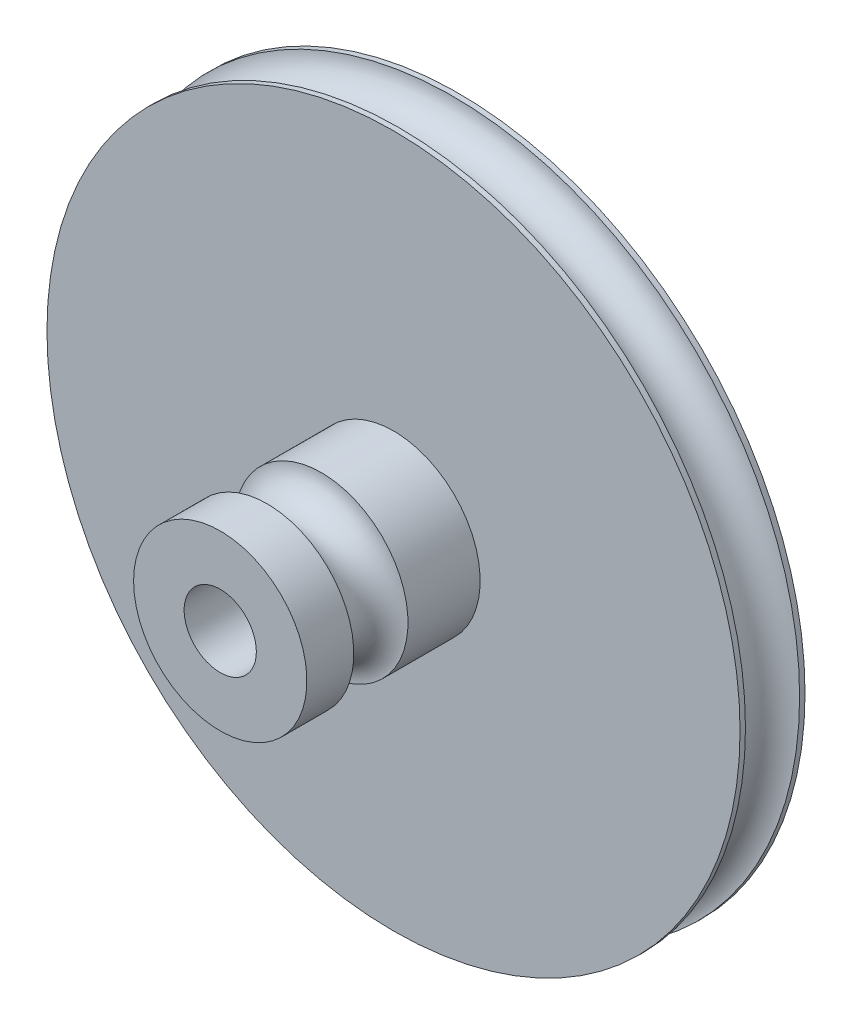
from build123d import *

# Parameters (mm, degrees)
BOSS_EXTRUDE1_START = -5.08
SKETCH1_R           = 15.24
SKETCH1_R_2         = 1.5875
BOSS_EXTRUDE1_DEPTH = 2.8575
SKETCH2_R           = 3.81
SKETCH2_R_2         = 1.5875
BOSS_EXTRUDE2_DEPTH = 7.62
SKETCH3_R           = 1.190625


with BuildPart() as part:
    # Sketch1 → Boss-Extrude1 (new body)
    with BuildSketch(Plane.XY.offset(BOSS_EXTRUDE1_START)):
        Circle(SKETCH1_R)
        Circle(SKETCH1_R_2, mode=Mode.SUBTRACT)
    extrude(amount=BOSS_EXTRUDE1_DEPTH)

    # Sketch2 → Boss-Extrude2 (add)
    with BuildSketch(Plane.XY.offset(-2.2225)):
        with Locations(Location((0, 0, 0), (0, 0, 180))):
            Circle(SKETCH2_R)
        Circle(SKETCH2_R_2, mode=Mode.SUBTRACT)
    extrude(amount=BOSS_EXTRUDE2_DEPTH)

    # Sketch3 → Cut-Revolve1 (revolve, cut)
    with BuildSketch(Plane(origin=(0, 0, 0), x_dir=(1, 0, 0), z_dir=(0, 1, 0)), mode=Mode.PRIVATE) as cut_revolve1_sk:
        with Locations((3.81, -2.143125)):
            Circle(SKETCH3_R)
        with Locations((15.24, 3.65125)):
            Circle(SKETCH3_R)
    revolve(cut_revolve1_sk.sketch.rotate(Axis((0, 0, -2.2225), (0, 0, -1)), 180), axis=Axis((0, 0, -2.2225), (0, 0, -1)), mode=Mode.SUBTRACT)


solid = part.part
